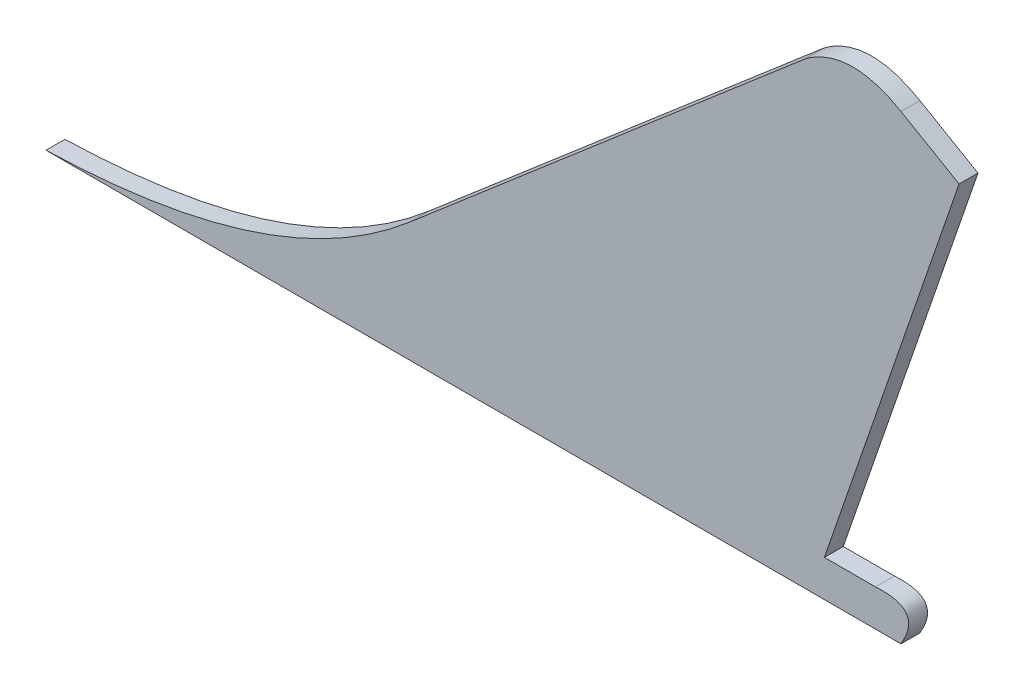
from build123d import *

# Parameters (mm, degrees)
BOSS_EXTRU_1_DEPTH = 100


with BuildPart() as part:
    # Esquisse1 → Boss.-Extru.1 (new body)
    with BuildSketch(Plane.XY):
        with BuildLine():
            Line((11654.93053423, 3598.529635923), (13748.284665994, 5393.367974263))
            add(Edge.make_bspline(
                [(13748.284665994, 5393.367974263), (13902.888830204, 5506.626297242), (14071.319622415, 5510.330813937), (14253.577042626, 5404.481524346)],
                knots=[0, 0, 0, 0, 1, 1, 1, 1], degree=3))
            Line((14253.577042626, 5404.481524346), (14561.065024047, 5225.902323822))
            Line((14561.065024047, 5225.902323822), (13848.245448642, 3158.60324779))
            Line((13848.245448642, 3158.60324779), (14118.832408858, 3158.60324779))
            add(Edge.make_bspline(
                [(14118.832408858, 3158.60324779), (14378.395991656, 3174.211265678), (14253.577042626, 2965.057281214)],
                knots=[0, 0, 0, 1, 1, 1], degree=2))
            Line((14253.577042626, 2965.057281214), (9730.007194676, 2965.057281214))
            add(Edge.make_bspline(
                [(9730.007194676, 2965.057281214), (10415.441098181, 2985.308122708), (11109.57533367, 3130.942997271), (11654.93053423, 3598.529635923)],
                knots=[0, 0, 0, 0, 1, 1, 1, 1], degree=3))
        make_face()
    extrude(amount=BOSS_EXTRU_1_DEPTH)


solid = part.part
